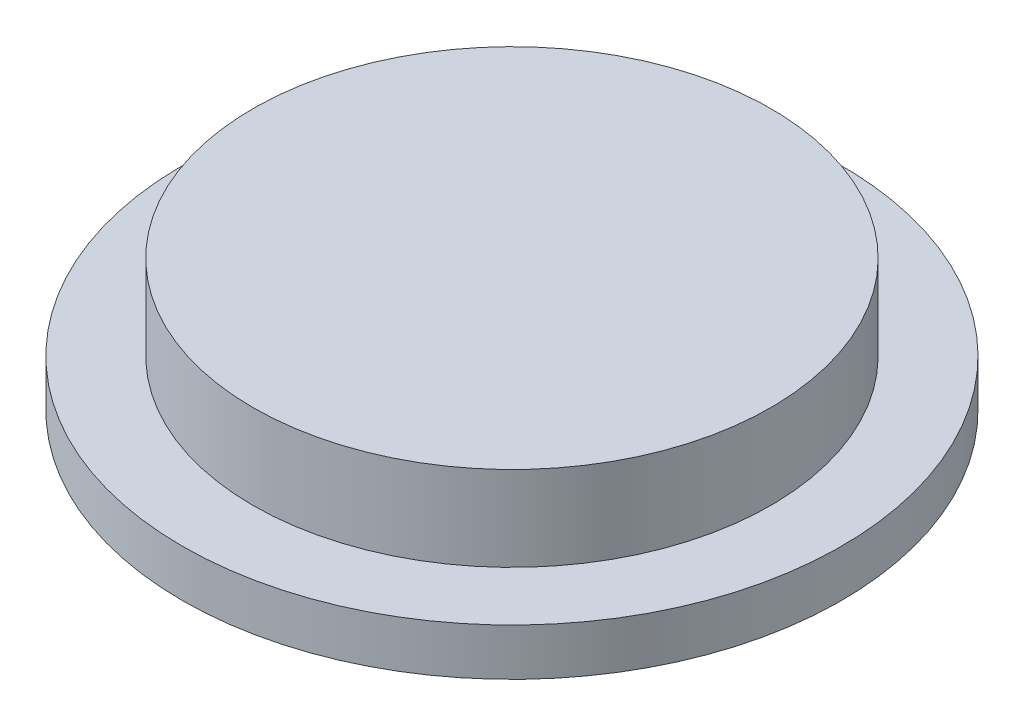
from build123d import *

# Parameters (mm, degrees)
SKETCH1_R           = 35
SKETCH1_R_2         = 1.5
SKETCH1_R_3         = 13
BOSS_EXTRUDE1_DEPTH = 5
SKETCH2_R           = 27.5
BOSS_EXTRUDE2_DEPTH = 9


with BuildPart() as part:
    # Sketch1 → Boss-Extrude1 (new body)
    with BuildSketch(Plane(origin=(0, 0, 0), x_dir=(1, 0, 0), z_dir=(0, 1, 0))):
        with Locations(Location((0, 0, 0), (0, 0, 270))):
            Circle(SKETCH1_R)
        with Locations(Location((0, 25.5, 0), (0, 0, 270))):
            Circle(SKETCH1_R_2, mode=Mode.SUBTRACT)
        with Locations(Location((22.083647797, 12.75, 0), (0, 0, 270))):
            Circle(SKETCH1_R_2, mode=Mode.SUBTRACT)
        with Locations(Location((22.083647797, -12.75, 0), (0, 0, 270))):
            Circle(SKETCH1_R_2, mode=Mode.SUBTRACT)
        with Locations(Location((0, -25.5, 0), (0, 0, 270))):
            Circle(SKETCH1_R_2, mode=Mode.SUBTRACT)
        with Locations(Location((-22.083647797, -12.75, 0), (0, 0, 270))):
            Circle(SKETCH1_R_2, mode=Mode.SUBTRACT)
        with Locations(Location((-22.083647797, 12.75, 0), (0, 0, 270))):
            Circle(SKETCH1_R_2, mode=Mode.SUBTRACT)
        with Locations(Location((0, 0, 0), (0, 0, 270))):
            Circle(SKETCH1_R_3, mode=Mode.SUBTRACT)
    extrude(amount=BOSS_EXTRUDE1_DEPTH)

    # Sketch2 → Boss-Extrude2 (add)
    with BuildSketch(Plane(origin=(0, 5, 0), x_dir=(1, 0, 0), z_dir=(0, 1, 0))):
        with Locations(Location((0, 0, 0), (0, 0, 270))):
            Circle(SKETCH2_R)
    extrude(amount=BOSS_EXTRUDE2_DEPTH)


solid = part.part
